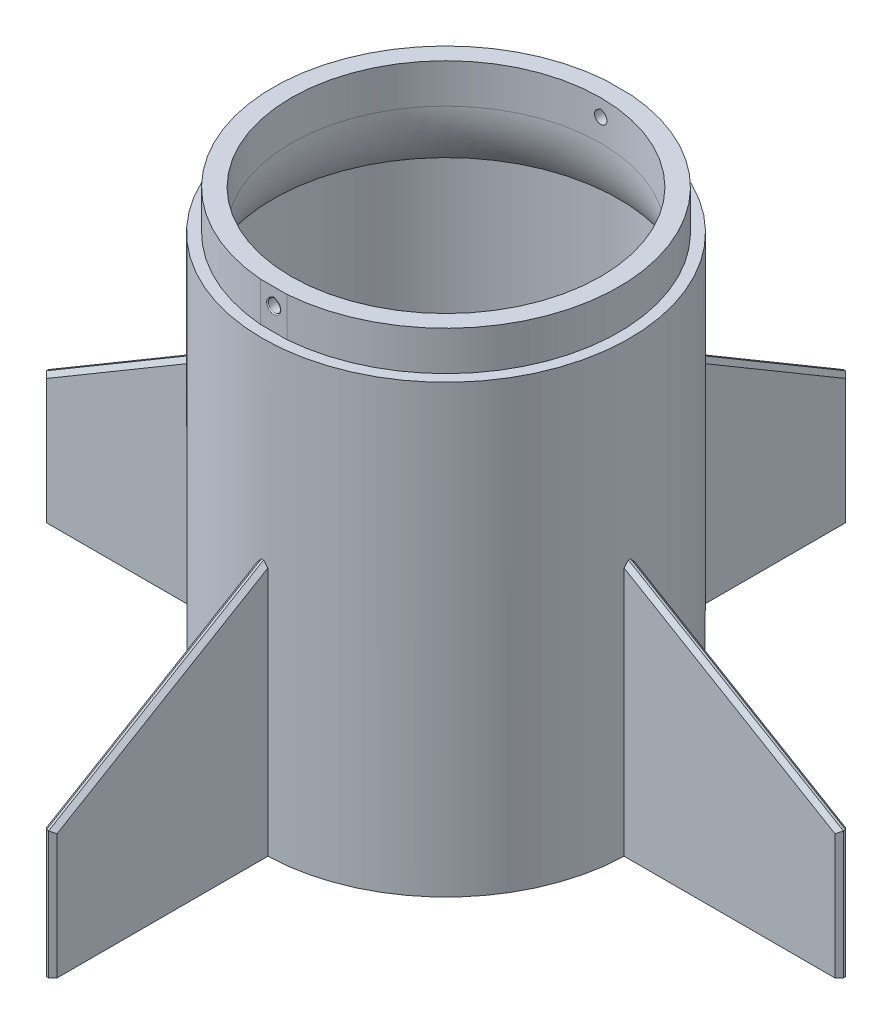
from build123d import *

# Parameters (mm, degrees)
SKETCH1_W                    = 4.318
SKETCH1_H                    = 9.398
SKETCH1_W_2                  = 2.54
SKETCH1_H_2                  = 106.68
BOSS_EXTRUDE3_DEPTH          = 1.27
CHAMFER1_SIZE                = 1.016
CIRPATTERN6_COUNT            = 4
CHAMFER1_OF_CIRPATTERN6_SIZE = 1.016
CUT_EXTRUDE6_DEPTH           = 164.591183691
CUT_EXTRUDE6_DEPTH_BACK      = 164.591183691
CUT_EXTRUDE7_START           = -9.398
CUT_EXTRUDE7_DEPTH           = 188.317430146
CIRPATTERN7_COUNT            = 2
FILLET1_R                    = 0.254


with BuildPart() as part:
    # Sketch1 → Revolve1 (revolve)
    with BuildSketch(Plane.XY, mode=Mode.PRIVATE) as revolve1_sk:
        with BuildLine():
            Line((-37.0459, 83.23489827), (-41.3639, 83.23489827))
            Line((-41.3639, 83.23489827), (-41.3639, 69.51194771))
            ThreePointArc((-41.3639, 69.51194771), (-38.150873616, 76.041767935), (-37.0459, 83.23489827))
        make_face()
        with Locations((-39.2049, 87.93389827)):
            Rectangle(SKETCH1_W, SKETCH1_H)
        with Locations((-42.6339, 29.89489827)):
            Rectangle(SKETCH1_W_2, SKETCH1_H_2)
    revolve(revolve1_sk.sketch.rotate(Axis((0, 21.7161892, 0), (0, -1, 0)), 270), axis=Axis((0, 21.7161892, 0), (0, -1, 0)))

    # Sketch4 → Boss-Extrude3 (add, symmetric)
    with BuildSketch(Plane(origin=(0, 0, 0), x_dir=(0, 0, -1), z_dir=(1, 0, 0))):
        Polygon((43.805829154, -23.44510173), (43.805829154, 37.51489827), (95.344694503, 7.03489827), (95.344694503, -23.44510173), align=None)
    boss_extrude3 = extrude(amount=BOSS_EXTRUDE3_DEPTH, both=True)

    # Chamfer1
    chamfer1_edges = [part.edges().sort_by_distance(p)[0] for p in [
        (-1.27, -8.20510173, -95.344694503),
        (1.27, -8.20510173, -95.344694503),
        (-1.27, 22.251331497, -69.615111065),
        (1.27, 22.251331497, -69.615111065),
    ]]
    chamfer(chamfer1_edges, length=CHAMFER1_SIZE)

    # CirPattern6: Boss-Extrude3 ×4 about axis
    cirpattern6_axis = Axis((0, 0, 0), (0, 1, 0))
    for i in range(1, CIRPATTERN6_COUNT):
        add(boss_extrude3.rotate(cirpattern6_axis, i * 360 / CIRPATTERN6_COUNT))

    # Chamfer1 of CirPattern6
    chamfer1_of_cirpattern6_edges = [part.edges().sort_by_distance(p)[0] for p in [
        (-95.344694503, -8.20510173, 1.27),
        (-95.344694503, -8.20510173, -1.27),
        (-69.615111065, 22.251331497, 1.27),
        (-69.615111065, 22.251331497, -1.27),
        (1.27, -8.20510173, 95.344694503),
        (-1.27, -8.20510173, 95.344694503),
        (1.27, 22.251331497, 69.615111065),
        (-1.27, 22.251331497, 69.615111065),
        (95.344694503, -8.20510173, -1.27),
        (95.344694503, -8.20510173, 1.27),
        (69.615111065, 22.251331497, -1.27),
        (69.615111065, 22.251331497, 1.27),
    ]]
    chamfer(chamfer1_of_cirpattern6_edges, length=CHAMFER1_OF_CIRPATTERN6_SIZE)

    # Sketch6 → Cut-Extrude6 (cut, two sides: drawn at the far end of the back side and taken through both)
    with BuildSketch(Plane.XY.offset(-CUT_EXTRUDE6_DEPTH_BACK)):
        with BuildLine():
            Line((-0.771031735, 89.852901434), (0, 90.323685317))
            Line((0, 90.323685317), (0.771031735, 89.852901434))
            ThreePointArc((0.771031735, 89.852901434), (0, 87.110585317), (-0.771031735, 89.852901434))
        make_face()
    extrude(amount=CUT_EXTRUDE6_DEPTH + CUT_EXTRUDE6_DEPTH_BACK, mode=Mode.SUBTRACT)

    # Sketch7 → Cut-Extrude7 (cut)
    with BuildSketch(Plane(origin=(0, 92.63289827, 0), x_dir=(1, 0, 0), z_dir=(0, 1, 0)).offset(CUT_EXTRUDE7_START)):
        with BuildLine():
            ThreePointArc((0, 41.3639), (-1.601400576, 41.332889318), (-3.2004, 41.239903771))
            Line((-3.2004, 41.239903771), (3.2004, 41.239903771))
            ThreePointArc((3.2004, 41.239903771), (1.601400576, 41.332889318), (0, 41.3639))
        make_face()
    cut_extrude7 = extrude(amount=CUT_EXTRUDE7_DEPTH, mode=Mode.SUBTRACT)

    # CirPattern7: Cut-Extrude7 ×2 about axis
    cirpattern7_axis = Axis((0, 21.7161892, 0), (0, 1, 0))
    for i in range(1, CIRPATTERN7_COUNT):
        add(cut_extrude7.rotate(cirpattern7_axis, i * 360 / CIRPATTERN7_COUNT), mode=Mode.SUBTRACT)

    # Fillet1
    fillet1_edges = [part.edges().sort_by_distance(p)[0] for p in [
        (0.385515867, 90.088293375, -41.239903771),
        (0, 87.110585317, -41.239903771),
        (-0.385515867, 90.088293375, -41.239903771),
        (0, 87.110585317, 41.239903771),
        (-0.385515867, 90.088293375, 41.239903771),
        (0.385515867, 90.088293375, 41.239903771),
    ]]
    fillet(fillet1_edges, radius=FILLET1_R)


solid = part.part
